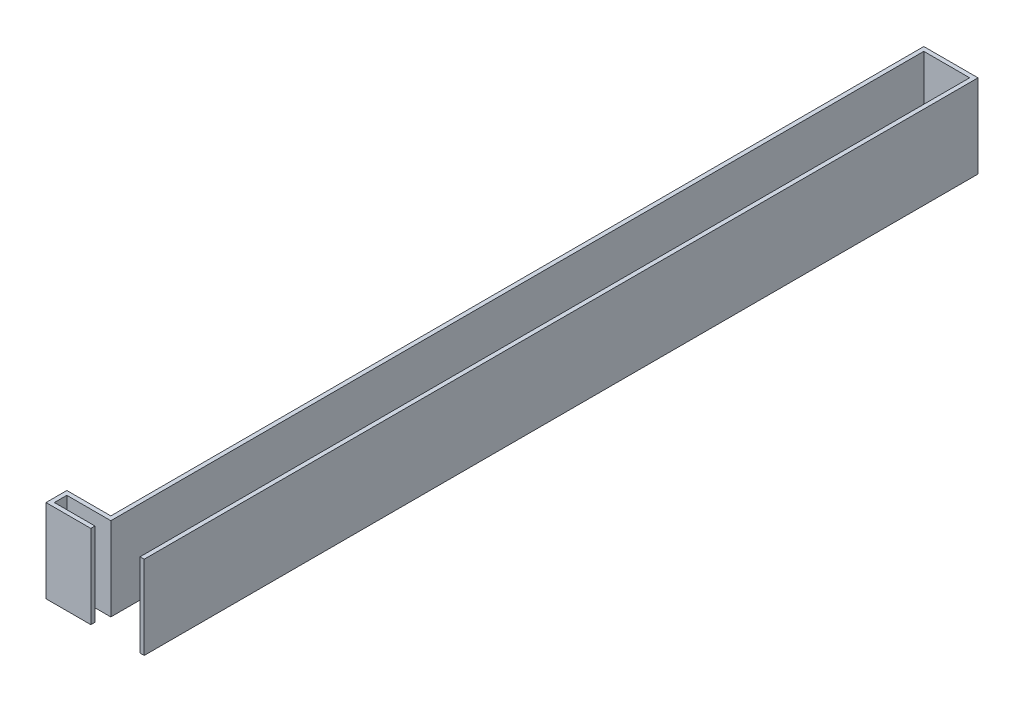
from build123d import *

# Parameters (mm, degrees)
BOSS_EXTRUDE1_DEPTH = 200


with BuildPart() as part:
    # Sketch2 → Boss-Extrude1 (new body)
    with BuildSketch(Plane(origin=(0, 0, 0), x_dir=(1, 0, 0), z_dir=(0, 1, 0))):
        Polygon((0, 0), (0, 2000), (-130, 2000), (-130, 50), (-235.5, 50), (-235.5, 40), (-235.5, 10), (-235.5, 0), (-128, 0), (-128, 10), (-225.5, 10), (-225.5, 40), (-120, 40), (-120, 1990), (-10, 1990), (-10, 2), (-10, 0), align=None)
    extrude(amount=BOSS_EXTRUDE1_DEPTH)


solid = part.part
